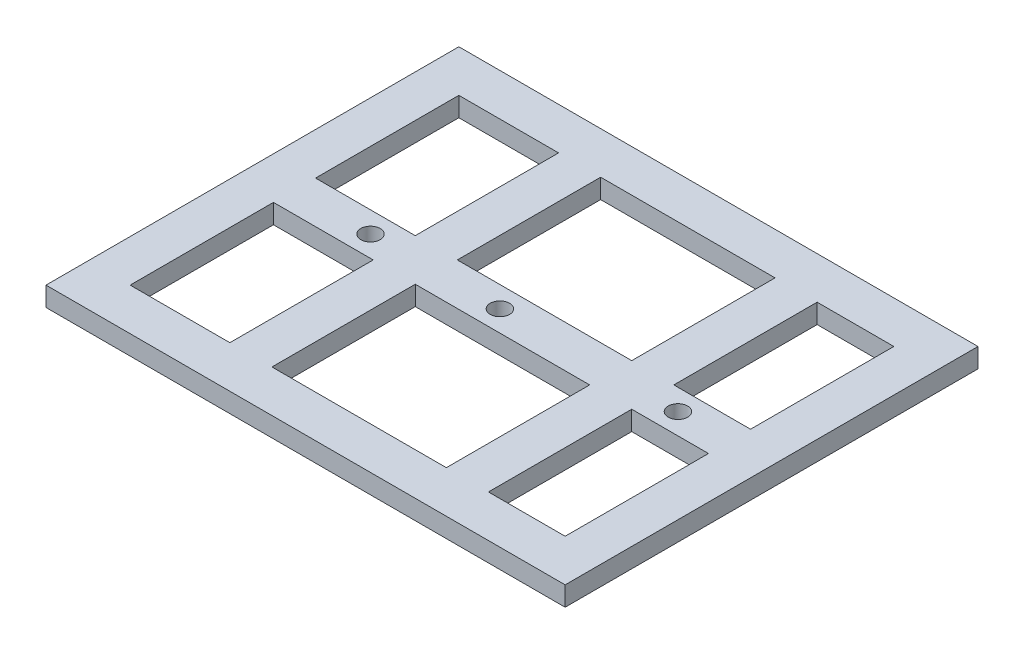
from build123d import *

# Parameters (mm, degrees)
SKETCH1_W           = 80.20256146
SKETCH1_H           = 63.780997334
SKETCH1_R           = 1.5
SKETCH1_W_2         = 15.405665538
SKETCH1_H_2         = 22.140498667
SKETCH1_W_3         = 11.853085899
SKETCH1_W_4         = 26.943810023
BOSS_EXTRUDE1_DEPTH = 1.5


with BuildPart() as part:
    # Sketch1 → Boss-Extrude1 (new, symmetric)
    with BuildSketch(Plane(origin=(0, 0, 0), x_dir=(1, 0, 0), z_dir=(0, 1, 0))):
        Rectangle(SKETCH1_W, SKETCH1_H)
        with Locations(Location((-21.864035064, 0, 0), (0, 0, 270))):
            Circle(SKETCH1_R, mode=Mode.SUBTRACT)
        with Locations(Location((-1.864035064, 0, 0), (0, 0, 270))):
            Circle(SKETCH1_R, mode=Mode.SUBTRACT)
        with Locations(Location((25.635964936, 0, 0), (0, 0, 270))):
            Circle(SKETCH1_R, mode=Mode.SUBTRACT)
        with Locations((-25.898447961, -14.320249334)):
            Rectangle(SKETCH1_W_2, SKETCH1_H_2, mode=Mode.SUBTRACT)
        with Locations((-25.898447961, 14.320249334)):
            Rectangle(SKETCH1_W_2, SKETCH1_H_2, mode=Mode.SUBTRACT)
        with Locations((27.674737781, -14.320249334)):
            Rectangle(SKETCH1_W_3, SKETCH1_H_2, mode=Mode.SUBTRACT)
        with Locations((1.77628982, 14.320249334)):
            Rectangle(SKETCH1_W_4, SKETCH1_H_2, mode=Mode.SUBTRACT)
        with Locations((27.674737781, 14.320249334)):
            Rectangle(SKETCH1_W_3, SKETCH1_H_2, mode=Mode.SUBTRACT)
        with Locations((1.77628982, -14.320249334)):
            Rectangle(SKETCH1_W_4, SKETCH1_H_2, mode=Mode.SUBTRACT)
    extrude(amount=BOSS_EXTRUDE1_DEPTH, both=True)


solid = part.part
